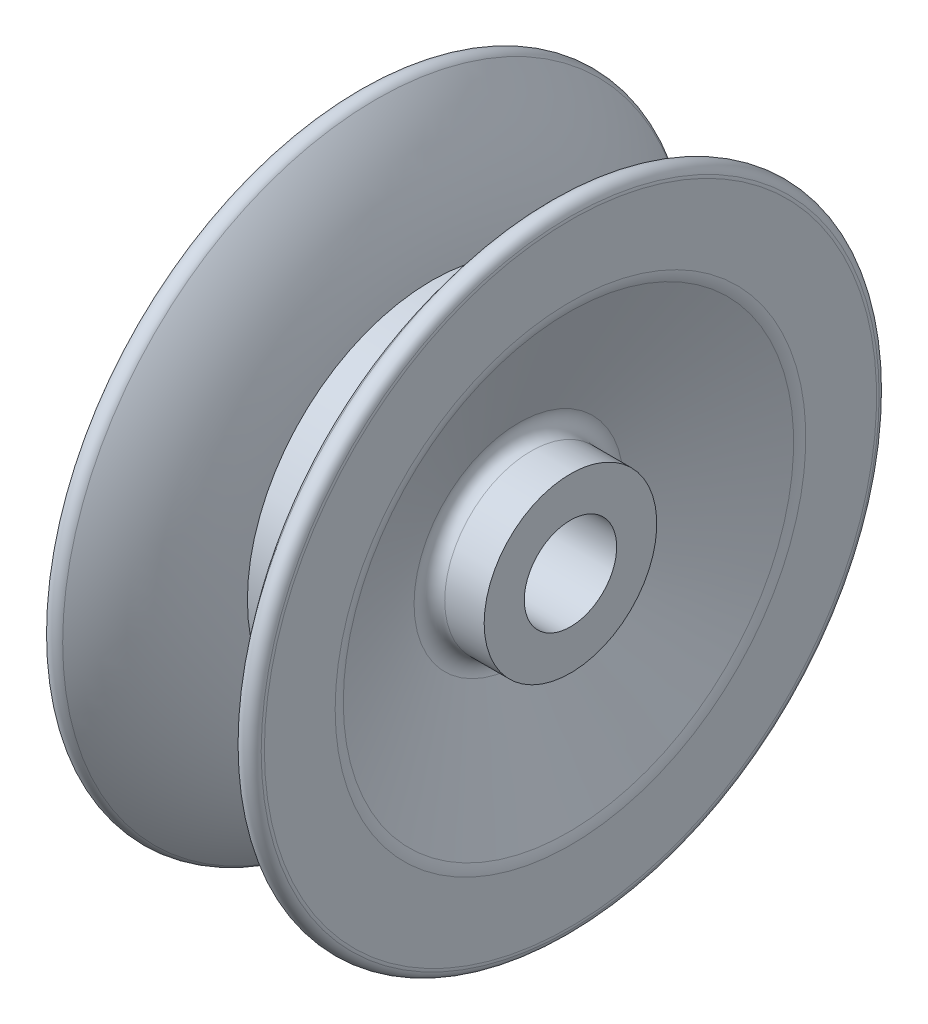
from build123d import *


with BuildPart() as part:
    # Sketch1 → Revolve1 (revolve)
    with BuildSketch(Plane.XY, mode=Mode.PRIVATE) as revolve1_sk:
        with BuildLine():
            Line((-18.54537414, -51.05459908), (-18.54537414, -34.169862124))
            ThreePointArc((-18.54537414, -34.169862124), (-18.424177234, -32.935150814), (-18.065212874, -31.747571217))
            Line((-18.065212874, -31.747571217), (-6.204339256, -3.00560007))
            ThreePointArc((-6.204339256, -3.00560007), (-6.500507799, -0.028776533), (-9.139258623, 1.380545384))
            Line((-9.139258623, 1.380545384), (-18.54537414, 1.380545384))
            Line((-18.54537414, 1.380545384), (-18.54537414, 10.947759434))
            Line((-18.54537414, 10.947759434), (32.25462586, 10.947759434))
            Line((32.25462586, 10.947759434), (32.25462586, 1.380545384))
            Line((32.25462586, 1.380545384), (22.848510342, 1.380545384))
            ThreePointArc((22.848510342, 1.380545384), (20.209759519, -0.028776533), (19.913590976, -3.00560007))
            Line((19.913590976, -3.00560007), (31.774464593, -31.747571217))
            ThreePointArc((31.774464593, -31.747571217), (32.133428953, -32.935150814), (32.25462586, -34.169862124))
            Line((32.25462586, -34.169862124), (32.25462586, -51.05459908))
            ThreePointArc((32.25462586, -51.05459908), (32.235953432, -51.398432266), (32.180155775, -51.738221232))
            ThreePointArc((32.180155775, -51.738221232), (30.321986734, -53.653923529), (27.776834687, -52.850861557))
            ThreePointArc((27.776834687, -52.850861557), (18.772917534, -38.474173066), (14.501540644, -22.057259971))
            Line((14.501540644, -22.057259971), (-0.792288925, -22.057259971))
            ThreePointArc((-0.792288925, -22.057259971), (-5.063665814, -38.474173066), (-14.067582967, -52.850861557))
            ThreePointArc((-14.067582967, -52.850861557), (-16.612735014, -53.653923529), (-18.470904055, -51.738221232))
            ThreePointArc((-18.470904055, -51.738221232), (-18.526701712, -51.398432266), (-18.54537414, -51.05459908))
        make_face()
    revolve(revolve1_sk.sketch.rotate(Axis((-18.542434148, 21.970400943, 0), (1, 0, 0)), 270), axis=Axis((-18.542434148, 21.970400943, 0), (1, 0, 0)))


solid = part.part
